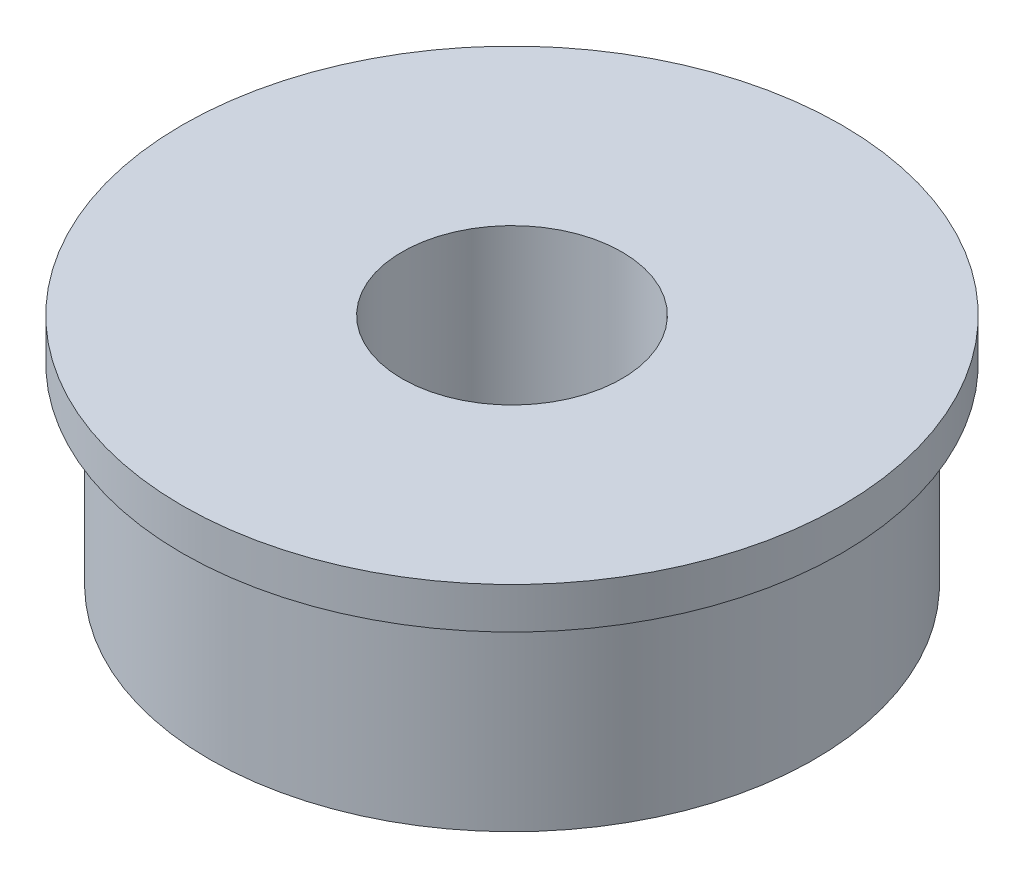
from build123d import *

# Parameters (mm, degrees)
SKETCH1_R           = 11
SKETCH1_R_2         = 4
BOSS_EXTRUDE1_DEPTH = 7
SKETCH2_R           = 12
SKETCH2_R_2         = 4
BOSS_EXTRUDE2_DEPTH = 1.5


with BuildPart() as part:
    # Sketch1 → Boss-Extrude1 (new body)
    with BuildSketch(Plane(origin=(0, 0, 0), x_dir=(1, 0, 0), z_dir=(0, 1, 0))):
        with Locations(Location((0, 0, 0), (0, 0, 270))):
            Circle(SKETCH1_R)
        with Locations(Location((0, 0, 0), (0, 0, 270))):
            Circle(SKETCH1_R_2, mode=Mode.SUBTRACT)
    extrude(amount=BOSS_EXTRUDE1_DEPTH)

    # Sketch2 → Boss-Extrude2 (add)
    with BuildSketch(Plane(origin=(0, 7, 0), x_dir=(1, 0, 0), z_dir=(0, 1, 0))):
        with Locations(Location((0, 0, 0), (0, 0, 270))):
            Circle(SKETCH2_R)
        with Locations(Location((0, 0, 0), (0, 0, 270))):
            Circle(SKETCH2_R_2, mode=Mode.SUBTRACT)
    extrude(amount=BOSS_EXTRUDE2_DEPTH)


solid = part.part
